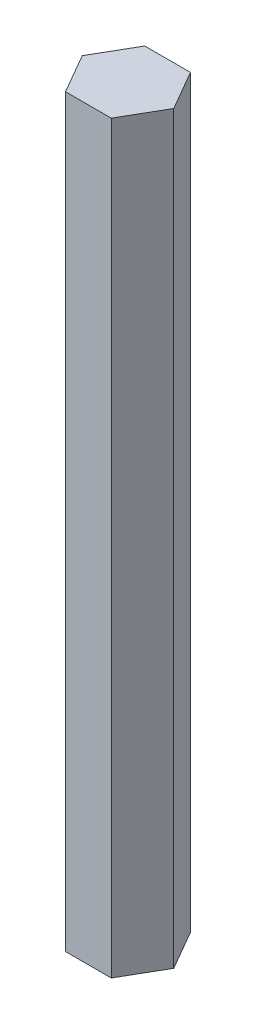
from build123d import *

# Parameters (mm, degrees)
BOSS_EXTRUDE1_DEPTH = 47


with BuildPart() as part:
    # Sketch1 → Boss-Extrude1 (new body)
    with BuildSketch(Plane(origin=(0, 0, 0), x_dir=(1, 0, 0), z_dir=(0, 1, 0))):
        Polygon((1.443375673, 2.5), (-1.443375673, 2.5), (-2.886751346, 0), (-1.443375673, -2.5), (1.443375673, -2.5), (2.886751346, 0), align=None)
    extrude(amount=BOSS_EXTRUDE1_DEPTH)


solid = part.part
